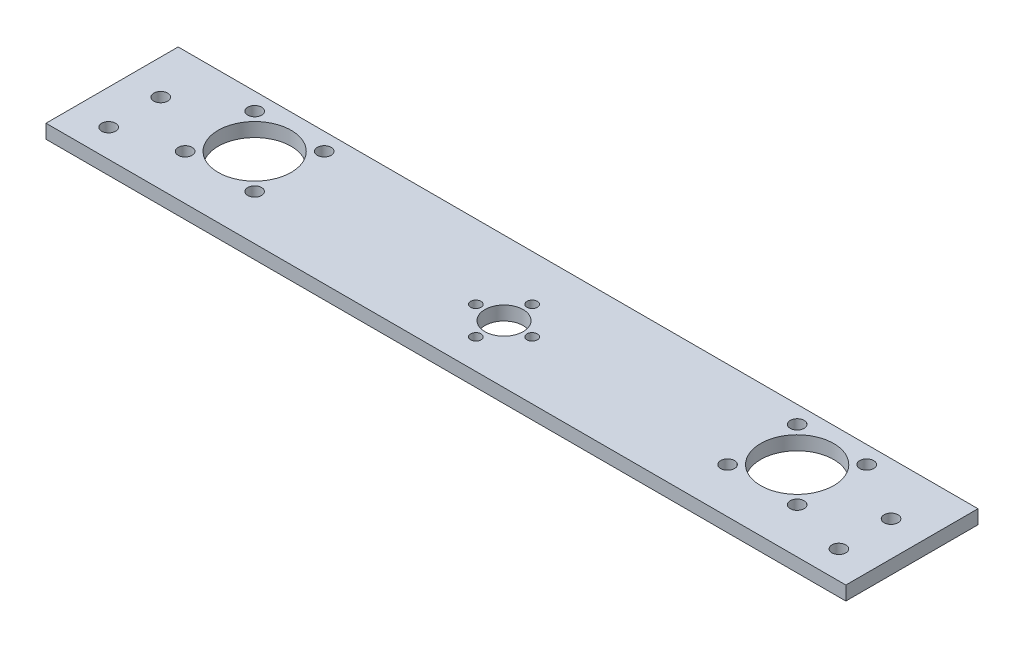
from build123d import *

# Parameters (mm, degrees)
SKETCH1_W           = 225
SKETCH1_H           = 38
BOSS_EXTRUDE1_DEPTH = 4
CUT_EXTRUDE1_REACH  = 118.5
SKETCH2_R           = 10.5
SKETCH2_R_2         = 5.5
SKETCH10_W          = 5
SKETCH10_H          = 38
BOSS_EXTRUDE2_DEPTH = 4
SKETCH11_R          = 2
CUT_EXTRUDE2_DEPTH  = 27
SKETCH12_R          = 2
CUT_EXTRUDE3_DEPTH  = 27
SKETCH14_R          = 1.5
CUT_EXTRUDE4_DEPTH  = 10
CIRPATTERN1_COUNT   = 4


with BuildPart() as part:
    # Sketch1 → Boss-Extrude1 (new body)
    with BuildSketch(Plane(origin=(0, 0, 0), x_dir=(1, 0, 0), z_dir=(0, 1, 0))):
        with Locations((0, 11)):
            Rectangle(SKETCH1_W, SKETCH1_H)
    extrude(amount=BOSS_EXTRUDE1_DEPTH)

    # Sketch2 → Cut-Extrude1 (cut, up to next)
    with BuildSketch(Plane(origin=(0, 4, 0), x_dir=(1, 0, 0), z_dir=(0, 1, 0)), mode=Mode.PRIVATE) as cut_extrude1_sk1:
        with Locations(Location((75.5, 15, 0), (0, 0, 270))):
            Circle(SKETCH2_R)
    cut_extrude1_tool1 = extrude(cut_extrude1_sk1.sketch, amount=-CUT_EXTRUDE1_REACH, mode=Mode.PRIVATE) & part.part
    # Sketch2 → Cut-Extrude1 (cut, up to next)
    with BuildSketch(Plane(origin=(0, 4, 0), x_dir=(1, 0, 0), z_dir=(0, 1, 0)), mode=Mode.PRIVATE) as cut_extrude1_sk2:
        with Locations(Location((-80.5, 15, 0), (0, 0, 270))):
            Circle(SKETCH2_R)
    cut_extrude1_tool2 = extrude(cut_extrude1_sk2.sketch, amount=-CUT_EXTRUDE1_REACH, mode=Mode.PRIVATE) & part.part
    # Sketch2 → Cut-Extrude1 (cut, up to next)
    with BuildSketch(Plane(origin=(0, 4, 0), x_dir=(1, 0, 0), z_dir=(0, 1, 0)), mode=Mode.PRIVATE) as cut_extrude1_sk3:
        with Locations(Location((-2.5, 8.7, 0), (0, 0, 270))):
            Circle(SKETCH2_R_2)
    cut_extrude1_tool3 = extrude(cut_extrude1_sk3.sketch, amount=-CUT_EXTRUDE1_REACH, mode=Mode.PRIVATE) & part.part
    add(cut_extrude1_tool1.solids().sort_by_distance((75.5, 4, -15))[0], mode=Mode.SUBTRACT)
    add(cut_extrude1_tool2.solids().sort_by_distance((-80.5, 4, -15))[0], mode=Mode.SUBTRACT)
    add(cut_extrude1_tool3.solids().sort_by_distance((-2.5, 4, -8.7))[0], mode=Mode.SUBTRACT)

    # Sketch10 → Boss-Extrude2 (add)
    with BuildSketch(Plane(origin=(0, 4, 0), x_dir=(1, 0, 0), z_dir=(0, 1, 0))):
        with Locations((-115, 11)):
            Rectangle(SKETCH10_W, SKETCH10_H)
        with Locations((100, 11)):
            Rectangle(SKETCH10_W, SKETCH10_H)
    extrude(amount=-BOSS_EXTRUDE2_DEPTH)

    # Sketch11 → Cut-Extrude2 (cut)
    with BuildSketch(Plane(origin=(0, 4, 0), x_dir=(1, 0, 0), z_dir=(0, 1, 0))):
        with Locations(Location((102.5, 0, 0), (0, 0, 270))):
            Circle(SKETCH11_R)
        with Locations(Location((102.5, 15, 0), (0, 0, 270))):
            Circle(SKETCH11_R)
        with Locations(Location((-107.5, 15, 0), (0, 0, 270))):
            Circle(SKETCH11_R)
        with Locations(Location((-107.5, 0, 0), (0, 0, 270))):
            Circle(SKETCH11_R)
    extrude(amount=-CUT_EXTRUDE2_DEPTH, mode=Mode.SUBTRACT)

    # Sketch12 → Cut-Extrude3 (cut)
    with BuildSketch(Plane(origin=(0, 4, 0), x_dir=(1, 0, 0), z_dir=(0, 1, 0))):
        with Locations(Location((65.5, 5, 0), (0, 0, 270))):
            Circle(SKETCH12_R)
        with Locations(Location((85.5, 5, 0), (0, 0, 270))):
            Circle(SKETCH12_R)
        with Locations(Location((85.5, 25, 0), (0, 0, 270))):
            Circle(SKETCH12_R)
        with Locations(Location((65.5, 25, 0), (0, 0, 270))):
            Circle(SKETCH12_R)
        with Locations(Location((-70.5, 25, 0), (0, 0, 270))):
            Circle(SKETCH12_R)
        with Locations(Location((-90.5, 25, 0), (0, 0, 270))):
            Circle(SKETCH12_R)
        with Locations(Location((-90.5, 5, 0), (0, 0, 270))):
            Circle(SKETCH12_R)
        with Locations(Location((-70.5, 5, 0), (0, 0, 270))):
            Circle(SKETCH12_R)
    extrude(amount=-CUT_EXTRUDE3_DEPTH, mode=Mode.SUBTRACT)

    # Sketch14 → Cut-Extrude4 (cut)
    with BuildSketch(Plane(origin=(0, 4, 0), x_dir=(1, 0, 0), z_dir=(0, 1, 0))):
        with Locations(Location((-2.5, 16.8, 0), (0, 0, 270))):
            Circle(SKETCH14_R)
    cut_extrude4 = extrude(amount=-CUT_EXTRUDE4_DEPTH, mode=Mode.SUBTRACT)

    # CirPattern1: Cut-Extrude4 ×4 about axis
    cirpattern1_axis = Axis((-2.5, 0, -8.7), (0, 1, 0))
    for i in range(1, CIRPATTERN1_COUNT):
        add(cut_extrude4.rotate(cirpattern1_axis, i * 360 / CIRPATTERN1_COUNT), mode=Mode.SUBTRACT)


solid = part.part
